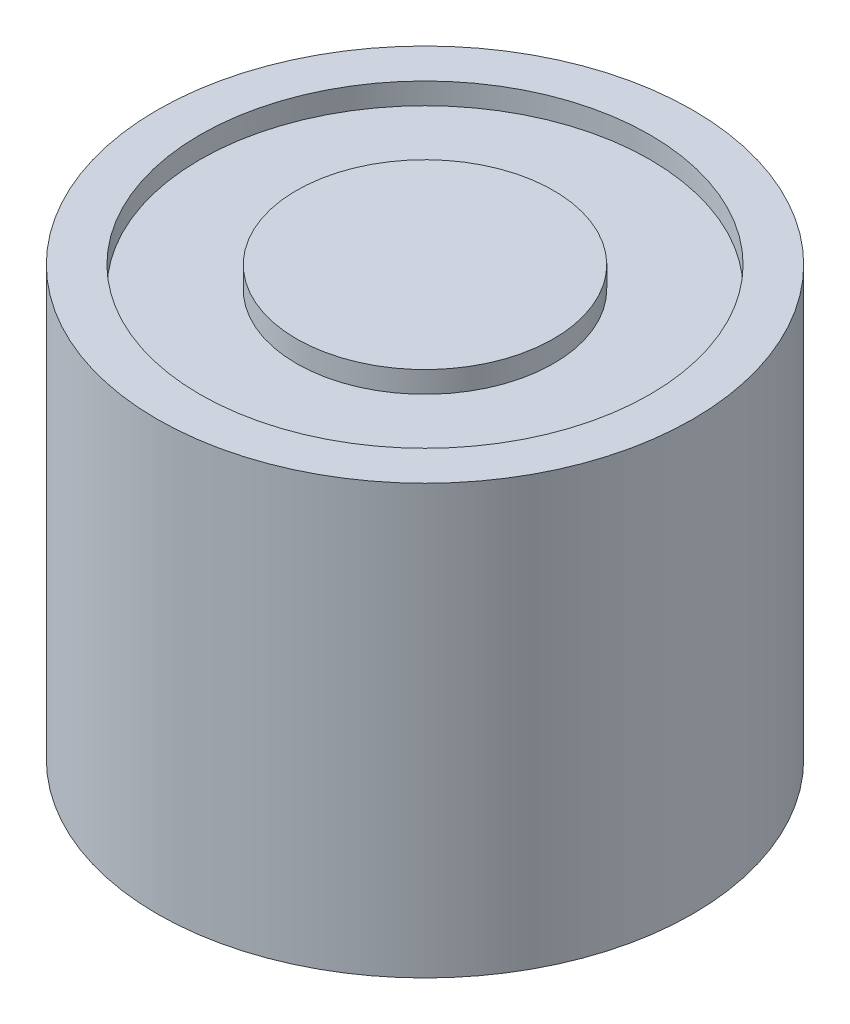
from build123d import *

# Parameters (mm, degrees)
SKETCH1_R           = 12.5
BOSS_EXTRUDE1_DEPTH = 20
SKETCH2_R           = 10.5
SKETCH2_R_2         = 6
CUT_EXTRUDE1_DEPTH  = 1


with BuildPart() as part:
    # Sketch1 → Boss-Extrude1 (new body)
    with BuildSketch(Plane(origin=(0, 0, 0), x_dir=(1, 0, 0), z_dir=(0, 1, 0))):
        with Locations(Location((0, 0, 0), (0, 0, 270))):
            Circle(SKETCH1_R)
    extrude(amount=BOSS_EXTRUDE1_DEPTH)

    # Sketch2 → Cut-Extrude1 (cut)
    with BuildSketch(Plane(origin=(0, 20, 0), x_dir=(1, 0, 0), z_dir=(0, 1, 0))):
        with Locations(Location((0, 0, 0), (0, 0, 270))):
            Circle(SKETCH2_R)
        with Locations(Location((0, 0, 0), (0, 0, 270))):
            Circle(SKETCH2_R_2, mode=Mode.SUBTRACT)
    extrude(amount=-CUT_EXTRUDE1_DEPTH, mode=Mode.SUBTRACT)


solid = part.part
